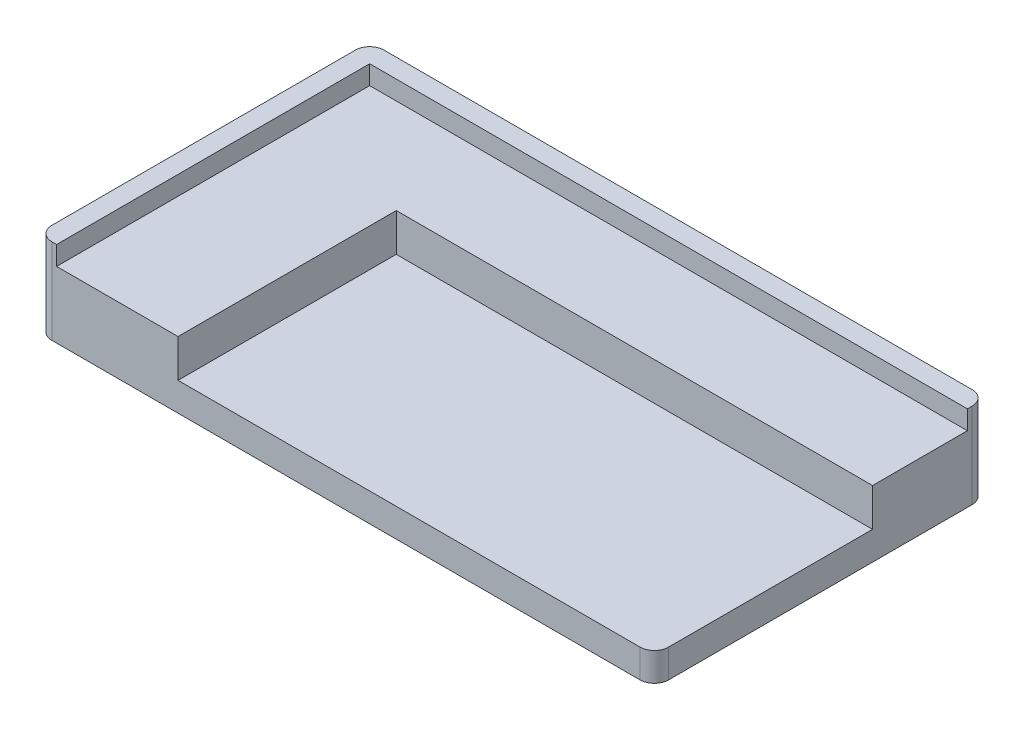
from build123d import *

# Parameters (mm, degrees)
SKETCH1_W           = 65
SKETCH1_H           = 35
BOSS_EXTRUDE1_DEPTH = 9
SKETCH2_W           = 63
SKETCH2_H           = 33
CUT_EXTRUDE1_DEPTH  = 2
SKETCH3_W           = 50.2
SKETCH3_H           = 23
CUT_EXTRUDE2_DEPTH  = 4
FILLET1_R           = 1.5


with BuildPart() as part:
    # Sketch1 → Boss-Extrude1 (new body)
    with BuildSketch(Plane(origin=(0, 0, 0), x_dir=(1, 0, 0), z_dir=(0, 1, 0))):
        with Locations((32.5, 17.5)):
            Rectangle(SKETCH1_W, SKETCH1_H)
    extrude(amount=BOSS_EXTRUDE1_DEPTH)

    # Sketch2 → Cut-Extrude1 (cut)
    with BuildSketch(Plane(origin=(0, 9, 0), x_dir=(1, 0, 0), z_dir=(0, 1, 0))):
        with Locations((33.5, 16.5)):
            Rectangle(SKETCH2_W, SKETCH2_H)
    extrude(amount=-CUT_EXTRUDE1_DEPTH, mode=Mode.SUBTRACT)

    # Sketch3 → Cut-Extrude2 (cut)
    with BuildSketch(Plane(origin=(0, 7, 0), x_dir=(1, 0, 0), z_dir=(0, 1, 0))):
        with Locations((39.9, 11.5)):
            Rectangle(SKETCH3_W, SKETCH3_H)
    extrude(amount=-CUT_EXTRUDE2_DEPTH, mode=Mode.SUBTRACT)

    # Fillet1
    fillet1_edges = [part.edges().sort_by_distance(p)[0] for p in [
        (65, 1.5, 0),
        (0, 4.5, -35),
        (65, 4.5, -35),
        (0, 4.5, 0),
    ]]
    fillet(fillet1_edges, radius=FILLET1_R)


solid = part.part
